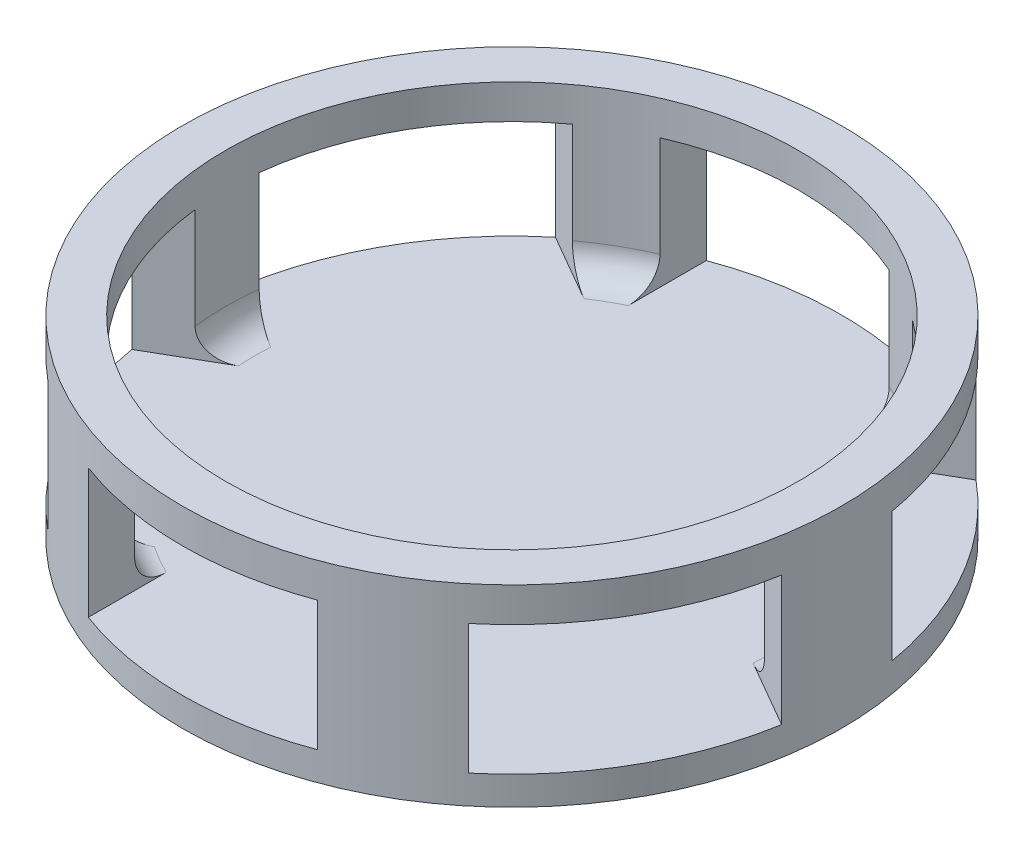
from build123d import *

# Parameters (mm, degrees)
SKETCH1_R           = 57.5
BOSS_EXTRUDE1_DEPTH = 33.6
SKETCH2_R           = 50
CUT_EXTRUDE1_DEPTH  = 28.6
FILLET1_R           = 5
SKETCH3_W           = 40
SKETCH3_H           = 22.6
CUT_EXTRUDE2_DEPTH  = 88.985566998
CIRPATTERN1_COUNT   = 3


with BuildPart() as part:
    # Sketch1 → Boss-Extrude1 (new body)
    with BuildSketch(Plane(origin=(0, 0, 0), x_dir=(1, 0, 0), z_dir=(0, 1, 0))):
        with Locations(Location((0, 0, 0), (0, 0, 270))):
            Circle(SKETCH1_R)
    extrude(amount=BOSS_EXTRUDE1_DEPTH)

    # Sketch2 → Cut-Extrude1 (cut)
    with BuildSketch(Plane(origin=(0, 33.6, 0), x_dir=(1, 0, 0), z_dir=(0, 1, 0))):
        with Locations(Location((0, 0, 0), (0, 0, 270))):
            Circle(SKETCH2_R)
    extrude(amount=-CUT_EXTRUDE1_DEPTH, mode=Mode.SUBTRACT)

    # Fillet1
    fillet1_edges = [part.edges().sort_by_distance(p)[0] for p in [
        (0, 5, -50),
    ]]
    fillet(fillet1_edges, radius=FILLET1_R)

    # Sketch3 → Cut-Extrude2 (cut, symmetric)
    with BuildSketch(Plane.XY):
        with Locations((0, 16.3)):
            Rectangle(SKETCH3_W, SKETCH3_H)
    cut_extrude2 = extrude(amount=CUT_EXTRUDE2_DEPTH, both=True, mode=Mode.SUBTRACT)

    # CirPattern1: Cut-Extrude2 ×3 about axis
    cirpattern1_axis = Axis((0, 0, 0), (0, 1, 0))
    for i in range(1, CIRPATTERN1_COUNT):
        add(cut_extrude2.rotate(cirpattern1_axis, i * 360 / CIRPATTERN1_COUNT), mode=Mode.SUBTRACT)


solid = part.part
